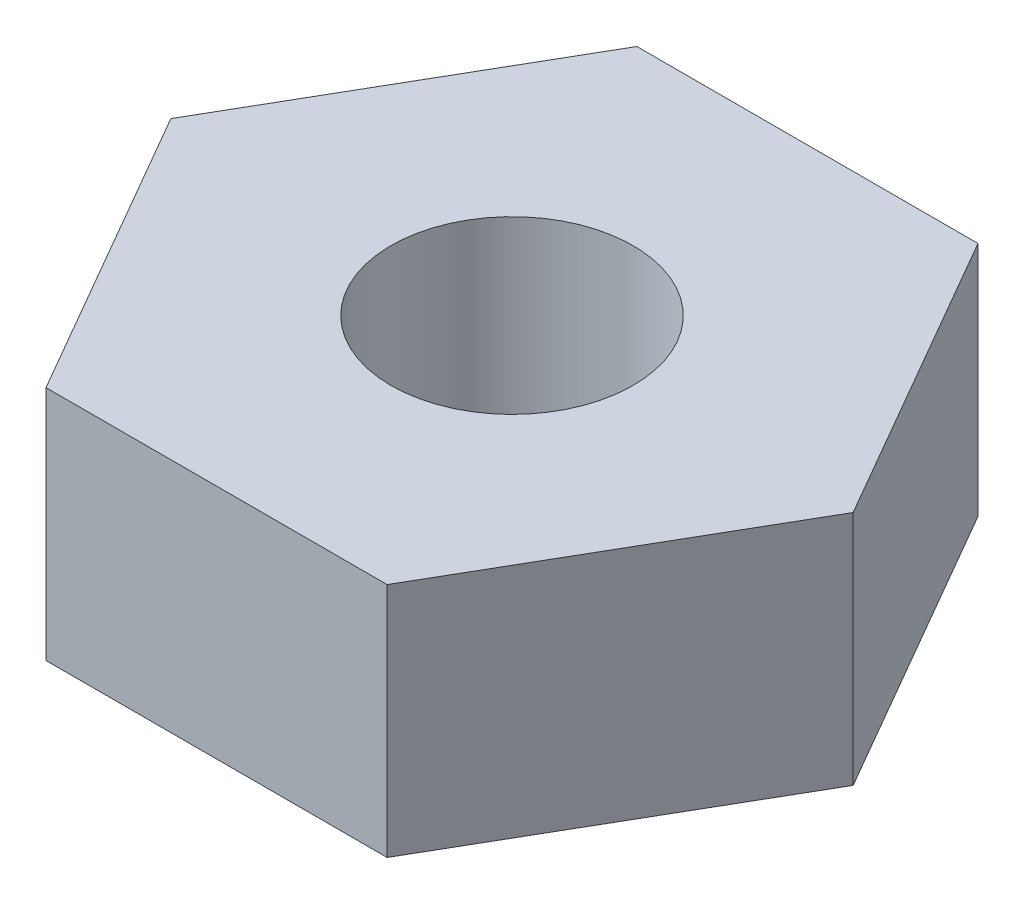
from build123d import *

# Parameters (mm, degrees)
CROQUIS1_R              = 1.025
SALIENTE_EXTRUIR1_DEPTH = 2


with BuildPart() as part:
    # Croquis1 → Saliente-Extruir1 (new body)
    with BuildSketch(Plane(origin=(0, 0, 0), x_dir=(1, 0, 0), z_dir=(0, 1, 0))):
        Polygon((-1.443375673, 2.5), (-2.886751346, 0), (-1.443375673, -2.5), (1.443375673, -2.5), (2.886751346, 0), (1.443375673, 2.5), align=None)
        with Locations(Location((0, 0, 0), (0, 0, 270))):
            Circle(CROQUIS1_R, mode=Mode.SUBTRACT)
    extrude(amount=SALIENTE_EXTRUIR1_DEPTH)


solid = part.part
